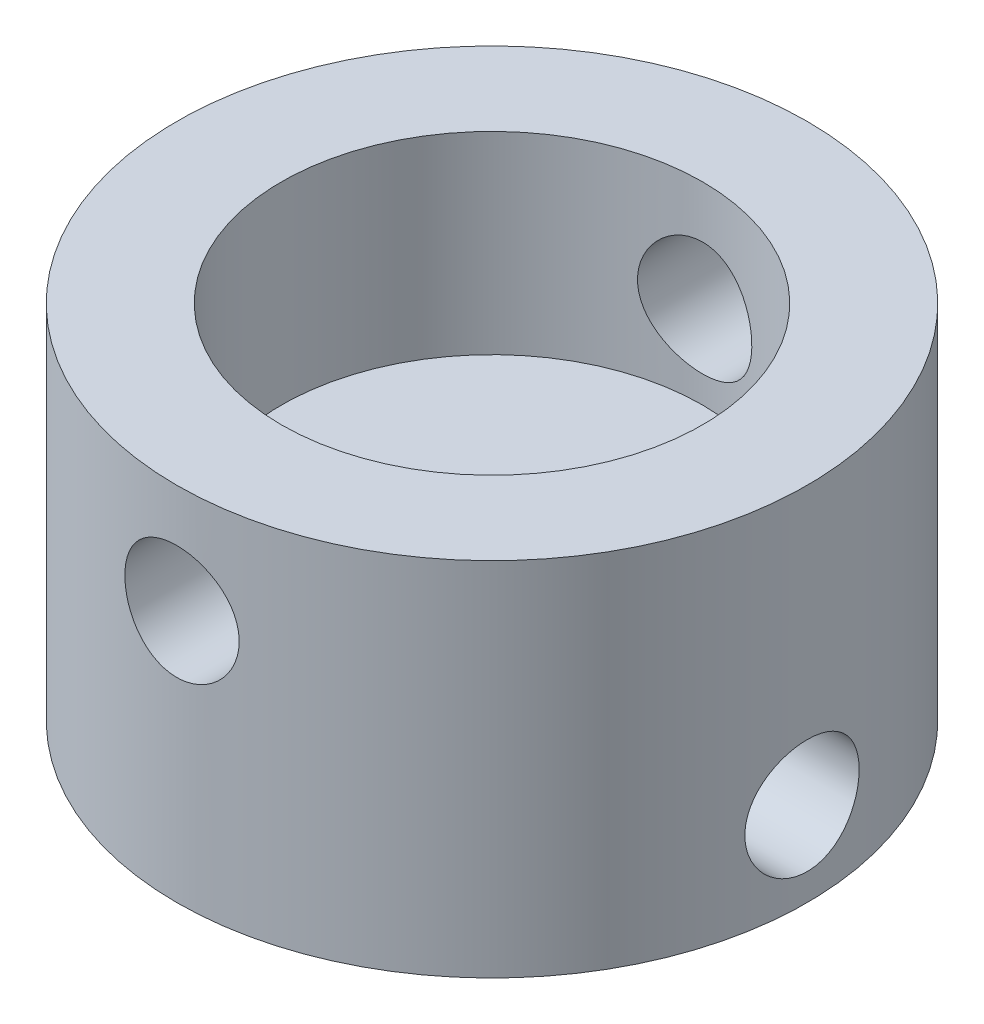
from build123d import *

# Parameters (mm, degrees)
SKETCH1_R           = 9.525
SKETCH1_R_2         = 2.9337
BOSS_EXTRUDE1_DEPTH = 5.08
SKETCH2_R           = 9.525
SKETCH2_R_2         = 6.3627
BOSS_EXTRUDE2_DEPTH = 5.842
SKETCH3_R           = 1.7272
CUT_EXTRUDE1_DEPTH  = 12.7
SKETCH4_R           = 1.7272
CUT_EXTRUDE2_DEPTH  = 12.7
SKETCH6_R           = 4.231677678
SKETCH6_R_2         = 1.4224
BOSS_EXTRUDE4_DEPTH = 0.762


with BuildPart() as part:
    # Sketch1 → Boss-Extrude1 (new body)
    with BuildSketch(Plane(origin=(0, 0, 0), x_dir=(1, 0, 0), z_dir=(0, 1, 0))):
        with Locations(Location((0, 0, 0), (0, 0, 270))):
            Circle(SKETCH1_R)
        with Locations(Location((0, 0, 0), (0, 0, 270))):
            Circle(SKETCH1_R_2, mode=Mode.SUBTRACT)
    extrude(amount=BOSS_EXTRUDE1_DEPTH)

    # Sketch2 → Boss-Extrude2 (add)
    with BuildSketch(Plane(origin=(0, 5.08, 0), x_dir=(1, 0, 0), z_dir=(0, 1, 0))):
        with Locations(Location((0, 0, 0), (0, 0, 270))):
            Circle(SKETCH2_R)
        with Locations(Location((0, 0, 0), (0, 0, 270))):
            Circle(SKETCH2_R_2, mode=Mode.SUBTRACT)
    extrude(amount=BOSS_EXTRUDE2_DEPTH)

    # Sketch3 → Cut-Extrude1 (cut, symmetric)
    with BuildSketch(Plane.XY):
        with Locations((0, 7.62)):
            Circle(SKETCH3_R)
    extrude(amount=CUT_EXTRUDE1_DEPTH, both=True, mode=Mode.SUBTRACT)

    # Sketch4 → Cut-Extrude2 (cut, symmetric)
    with BuildSketch(Plane(origin=(0, 0, 0), x_dir=(0, 0, -1), z_dir=(1, 0, 0))):
        with Locations((0, 2.54)):
            Circle(SKETCH4_R)
    extrude(amount=CUT_EXTRUDE2_DEPTH, both=True, mode=Mode.SUBTRACT)

    # Sketch6 → Boss-Extrude4 (add)
    with BuildSketch(Plane(origin=(0, 5.08, 0), x_dir=(1, 0, 0), z_dir=(0, 1, 0))):
        Circle(SKETCH6_R)
        with Locations(Location((0, 0, 0), (0, 0, 270))):
            Circle(SKETCH6_R_2, mode=Mode.SUBTRACT)
    extrude(amount=-BOSS_EXTRUDE4_DEPTH)


solid = part.part
